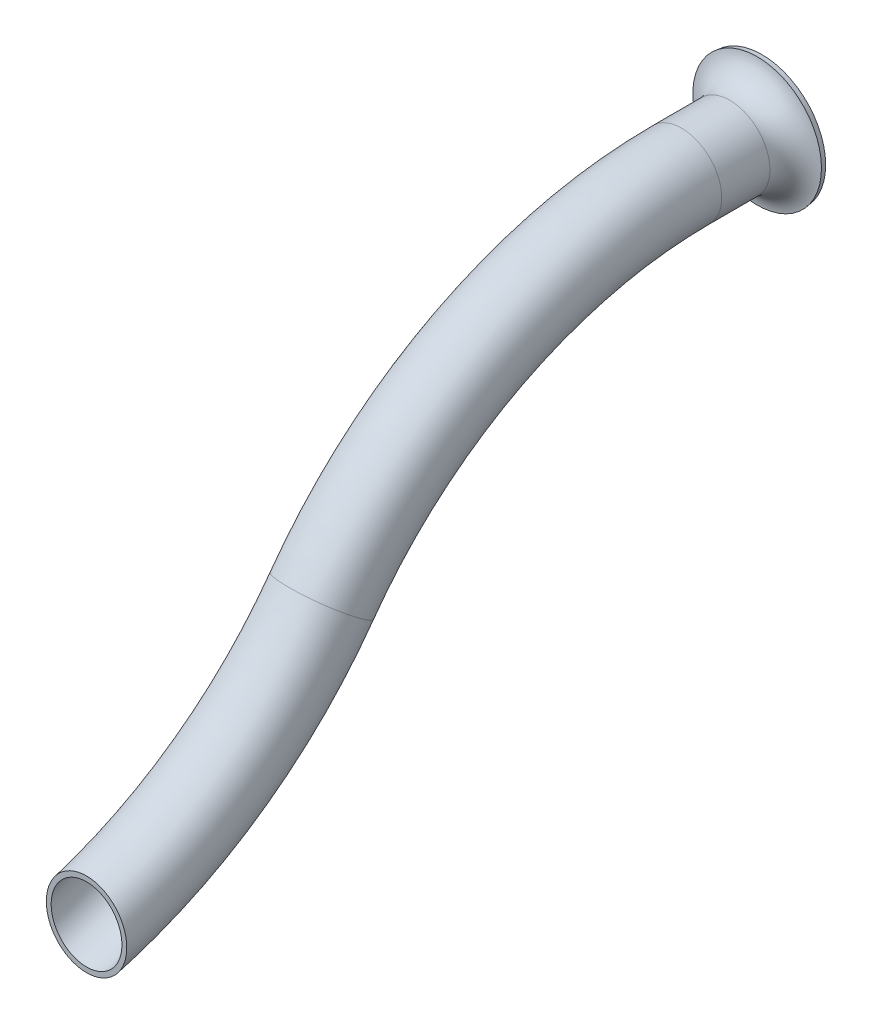
from build123d import *

# Parameters (mm, degrees)
SKETCH2_R          = 2.5
SKETCH2_R_2        = 2.2
SKETCH3_W          = 7.732538493
SKETCH3_H          = 7
CUT_EXTRUDE1_DEPTH = 5


with BuildPart() as part:
    # Sweep1: sweep along a path in Sketch1
    with BuildLine(Plane(origin=(0, 0, 0), x_dir=(0, 0, -1), z_dir=(1, 0, 0))) as sweep1_path:
        Line((0, 23), (-3, 23))
        ThreePointArc((-3, 23), (-15.57477634, 19.956594203), (-25.366269246, 11.5))
        ThreePointArc((-25.366269246, 11.5), (-31.811636627, 5.077357788), (-40, 1.10951216))
        ThreePointArc((-40, 1.10951216), (-43.826672111, 0.278791213), (-47.732538493, 0))
    # Sketch2 → Sweep1 (sweep)
    with BuildSketch(Plane.XY):
        with Locations((0, 23)):
            Circle(SKETCH2_R)
        with Locations((0, 23)):
            Circle(SKETCH2_R_2, mode=Mode.SUBTRACT)
    sweep(path=sweep1_path.line)

    # Sketch3 → Cut-Extrude1 (cut, symmetric)
    with BuildSketch(Plane(origin=(0, 0, 0), x_dir=(0, 0, -1), z_dir=(1, 0, 0))):
        with Locations((-43.866269246, 1)):
            Rectangle(SKETCH3_W, SKETCH3_H)
    extrude(amount=CUT_EXTRUDE1_DEPTH, both=True, mode=Mode.SUBTRACT)

    # Sketch4 → Revolve1 (revolve)
    with BuildSketch(Plane(origin=(0, 0, 0), x_dir=(0, 0, -1), z_dir=(1, 0, 0)), mode=Mode.PRIVATE) as revolve1_sk:
        with BuildLine():
            Line((0, 25.2), (0, 25.5))
            ThreePointArc((0, 25.5), (1.13447358, 25.928498418), (1.702386917, 27))
            Line((1.702386917, 27), (2, 26.962231588))
            ThreePointArc((2, 26.962231588), (1.332803452, 25.703408965), (0, 25.2))
        make_face()
    revolve(revolve1_sk.sketch.rotate(Axis((0, 23, 0), (0, 0, -1)), 90), axis=Axis((0, 23, 0), (0, 0, -1)))


solid = part.part
